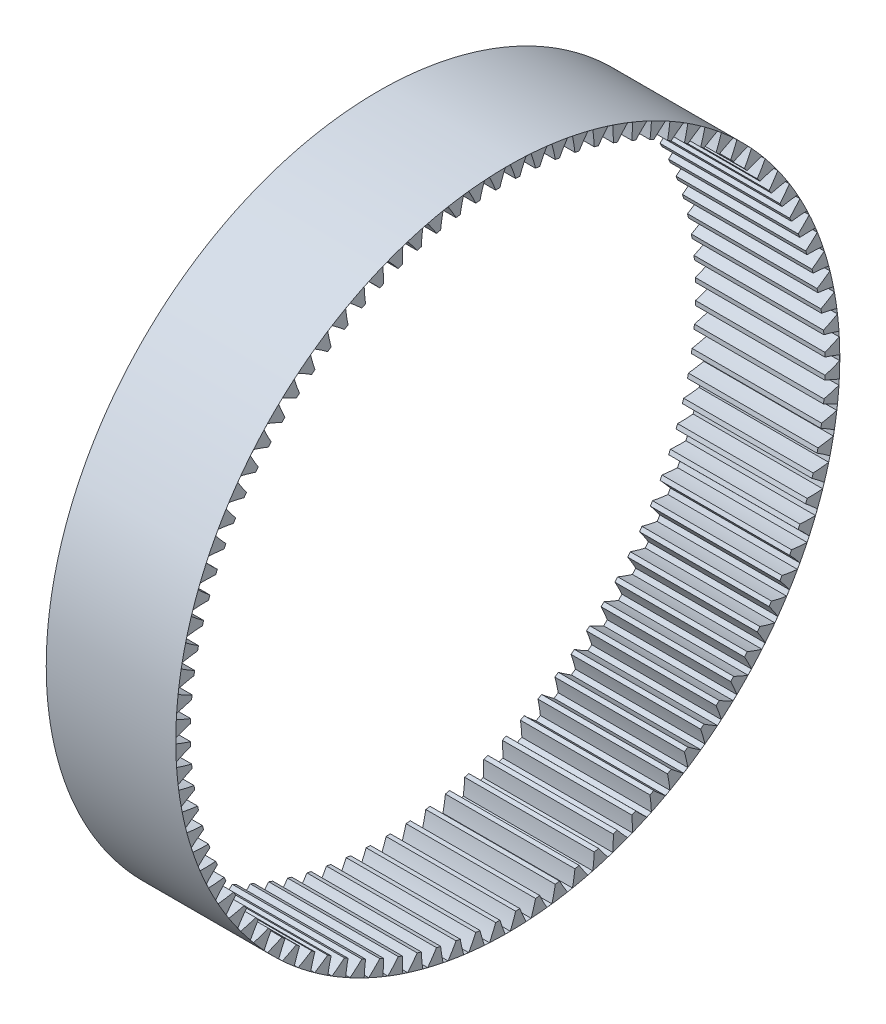
from build123d import *

# Parameters (mm, degrees)
BASPROSKE_W     = 60
BASPROSKE_H     = 6.7764
TOOTHCUT_DEPTH  = 226.597788983
TEETHCUTS_COUNT = 100
TEETHCUTS_ANGLE = 356.4


with BuildPart() as part:
    # BasProSke → Base-Revolve (revolve)
    with BuildSketch(Plane(origin=(0, 0, 0), x_dir=(1, 0, 0), z_dir=(0, 1, 0)), mode=Mode.PRIVATE) as base_revolve_sk:
        with Locations((30, 150.3882)):
            Rectangle(BASPROSKE_W, BASPROSKE_H)
    revolve(base_revolve_sk.sketch.rotate(Axis((-10, 0, 0), (1, 0, 0)), 180), axis=Axis((-10, 0, 0), (1, 0, 0)))

    # TooCutSke → ToothCut (cut, through all)
    with BuildSketch(Plane(origin=(0, 0, 0), x_dir=(0, 0, -1), z_dir=(1, 0, 0))):
        with BuildLine():
            ThreePointArc((3.637427826, 146.929582331), (2.482947495, 150.368007742), (1.163580625, 153.746596974))
            ThreePointArc((1.163580625, 153.746596974), (0, 153.751), (-1.163580625, 153.746596974))
            ThreePointArc((-1.163580625, 153.746596974), (-2.482947495, 150.368007742), (-3.637427826, 146.929582331))
            ThreePointArc((-3.637427826, 146.929582331), (0, 146.9746), (3.637427826, 146.929582331))
        make_face()
    toothcut = extrude(amount=TOOTHCUT_DEPTH, mode=Mode.SUBTRACT)

    # TeethCuts: ToothCut ×100 about axis
    teethcuts_axis = Axis((-10, 0, 0), (1, 0, 0))
    for i in range(1, TEETHCUTS_COUNT):
        add(toothcut.rotate(teethcuts_axis, i * TEETHCUTS_ANGLE / (TEETHCUTS_COUNT - 1)), mode=Mode.SUBTRACT)


solid = part.part
